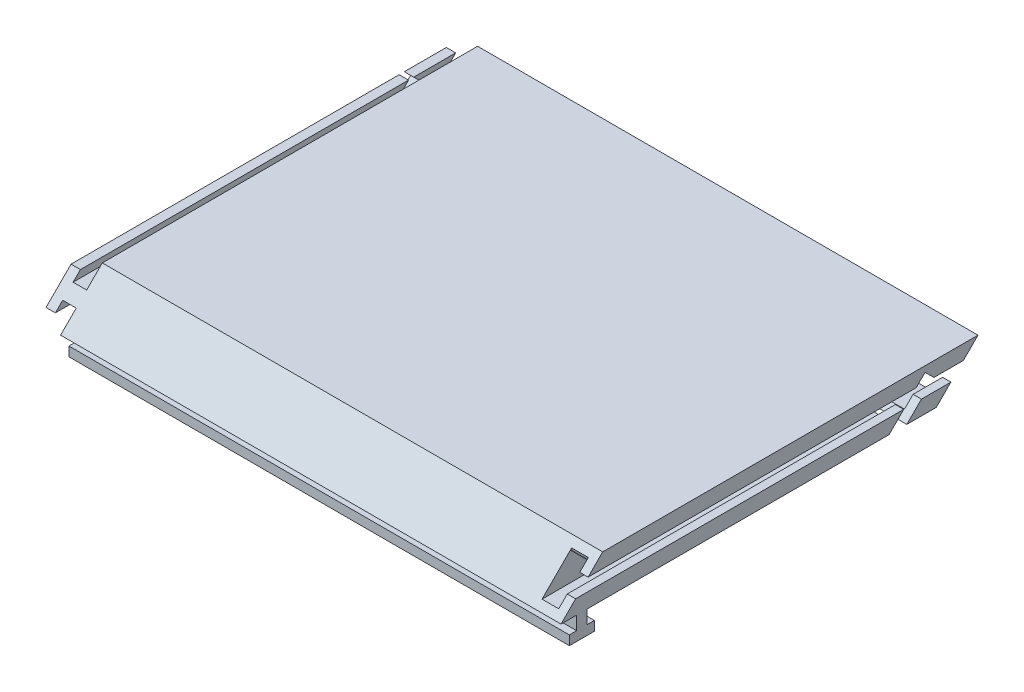
from build123d import *

# Parameters (mm, degrees)
SKETCH1_W           = 120
SKETCH1_H           = 100
BOSS_EXTRUDE1_DEPTH = 10
SKETCH2_W           = 6
SKETCH2_H           = 3
CUT_EXTRUDE1_DEPTH  = 120
SKETCH3_W           = 3
SKETCH3_H           = 1.75
CUT_EXTRUDE2_DEPTH  = 120
SKETCH4_W           = 3
SKETCH4_H           = 1.75
CUT_EXTRUDE3_DEPTH  = 120
SKETCH5_W           = 100
SKETCH5_H           = 3
BOSS_EXTRUDE2_DEPTH = 6
SKETCH6_W           = 3
SKETCH6_H           = 100
BOSS_EXTRUDE3_DEPTH = 1.75
SKETCH8_W           = 3
SKETCH8_H           = 100
BOSS_EXTRUDE4_DEPTH = 1.75
CUT_EXTRUDE4_DEPTH  = 140
CUT_EXTRUDE5_DEPTH  = 140
SKETCH12_W          = 120
SKETCH12_H          = 3
BOSS_EXTRUDE5_DEPTH = 6
SKETCH13_W          = 120
SKETCH13_H          = 3
BOSS_EXTRUDE6_DEPTH = 1.75
SKETCH14_W          = 120
SKETCH14_H          = 3
BOSS_EXTRUDE7_DEPTH = 1.75
SKETCH15_W          = 3.971349668
SKETCH15_H          = 100.27962334
CUT_EXTRUDE7_DEPTH  = 0.25
SKETCH16_W          = 3.977727367
SKETCH16_H          = 100.113606744
CUT_EXTRUDE8_DEPTH  = 0.25
SKETCH18_W          = 99.392543401
SKETCH18_H          = 7.459446395
CUT_EXTRUDE9_DEPTH  = 0.25
SKETCH19_W          = 3
SKETCH19_H          = 91.258373497
CUT_EXTRUDE10_DEPTH = 0.25
SKETCH22_W          = 3
SKETCH22_H          = 105.56058455
CUT_EXTRUDE11_DEPTH = 0.25
SKETCH23_W          = 145.417072626
SKETCH23_H          = 16.376201687
CUT_EXTRUDE12_DEPTH = 0.25
SKETCH24_W          = 92.054908244
SKETCH24_H          = 1.75
CUT_EXTRUDE13_DEPTH = 0.25
SKETCH25_W          = 91.75
SKETCH25_H          = 1.75
CUT_EXTRUDE14_DEPTH = 0.25
SKETCH27_W          = 146.123968395
SKETCH27_H          = 10.969132505
CUT_EXTRUDE15_DEPTH = 0.25
SKETCH28_W          = 131.910387722
SKETCH28_H          = 9.70209764
CUT_EXTRUDE16_DEPTH = 0.25
SKETCH29_W          = 147.06215687
SKETCH29_H          = 25.738379838
CUT_EXTRUDE17_DEPTH = 0.25
SKETCH30_W          = 120
SKETCH30_H          = 3
CUT_EXTRUDE18_DEPTH = 0.25
SKETCH31_W          = 120
SKETCH31_H          = 3
CUT_EXTRUDE19_DEPTH = 0.25
SKETCH32_W          = 120
SKETCH32_H          = 1.75
CUT_EXTRUDE20_DEPTH = 0.25
SKETCH33_W          = 120
SKETCH33_H          = 1.75
CUT_EXTRUDE21_DEPTH = 0.25
SKETCH36_W          = 96.5
SKETCH36_H          = 6.5
CUT_EXTRUDE23_DEPTH = 0.5
SKETCH39_W          = 96.5
SKETCH39_H          = 6.5
CUT_EXTRUDE27_DEPTH = 0.5
SKETCH41_W          = 4
SKETCH41_H          = 91.70363903
CUT_EXTRUDE28_DEPTH = 0.3
SKETCH42_W          = 3.987472746
SKETCH42_H          = 92.170181705
CUT_EXTRUDE29_DEPTH = 0.3
CUT_EXTRUDE30_DEPTH = 150
SKETCH44_W          = 120
SKETCH44_H          = 6
CUT_EXTRUDE31_DEPTH = 0.25
CUT_EXTRUDE32_DEPTH = 150


with BuildPart() as part:
    # Sketch1 → Boss-Extrude1 (new body)
    with BuildSketch(Plane(origin=(0, 0, 0), x_dir=(1, 0, 0), z_dir=(0, 1, 0))):
        with Locations((-60, -57.341499956)):
            Rectangle(SKETCH1_W, SKETCH1_H)
    extrude(amount=BOSS_EXTRUDE1_DEPTH)

    # Sketch2 → Cut-Extrude1 (cut)
    with BuildSketch(Plane(origin=(0, 0, 7.341499956), x_dir=(-1, 0, 0), z_dir=(0, 0, -1))):
        with Locations((3, 5)):
            Rectangle(SKETCH2_W, SKETCH2_H)
    extrude(amount=-CUT_EXTRUDE1_DEPTH, mode=Mode.SUBTRACT)

    # Sketch3 → Cut-Extrude2 (cut)
    with BuildSketch(Plane(origin=(0, 0, 7.341499956), x_dir=(-1, 0, 0), z_dir=(0, 0, -1))):
        with Locations((4.5, 7.375)):
            Rectangle(SKETCH3_W, SKETCH3_H)
    extrude(amount=-CUT_EXTRUDE2_DEPTH, mode=Mode.SUBTRACT)

    # Sketch4 → Cut-Extrude3 (cut)
    with BuildSketch(Plane(origin=(0, 0, 7.341499956), x_dir=(-1, 0, 0), z_dir=(0, 0, -1))):
        with Locations((4.5, 2.625)):
            Rectangle(SKETCH4_W, SKETCH4_H)
    extrude(amount=-CUT_EXTRUDE3_DEPTH, mode=Mode.SUBTRACT)

    # Sketch5 → Boss-Extrude2 (add)
    with BuildSketch(Plane.ZY.offset(120)):
        with Locations((57.341499956, 5)):
            Rectangle(SKETCH5_W, SKETCH5_H)
    extrude(amount=BOSS_EXTRUDE2_DEPTH)

    # Sketch6 → Boss-Extrude3 (add)
    with BuildSketch(Plane(origin=(0, 3.5, 0), x_dir=(-1, 0, 0), z_dir=(0, -1, 0))):
        with Locations((124.5, -57.341499956)):
            Rectangle(SKETCH6_W, SKETCH6_H)
    extrude(amount=BOSS_EXTRUDE3_DEPTH)

    # Sketch8 → Boss-Extrude4 (add)
    with BuildSketch(Plane(origin=(0, 6.5, 0), x_dir=(1, 0, 0), z_dir=(0, 1, 0))):
        with Locations((-124.5, -57.341499956)):
            Rectangle(SKETCH8_W, SKETCH8_H)
    extrude(amount=BOSS_EXTRUDE4_DEPTH)

    # Sketch9 → Cut-Extrude4 (cut)
    with BuildSketch(Plane(origin=(0, 0, 0), x_dir=(0, 0, -1), z_dir=(1, 0, 0))):
        Polygon((-7.341499956, 0), (-7.341499956, 10), (-17.341499956, 0), align=None)
    extrude(amount=-CUT_EXTRUDE4_DEPTH, mode=Mode.SUBTRACT)

    # Sketch10 → Cut-Extrude5 (cut)
    with BuildSketch(Plane(origin=(0, 0, 0), x_dir=(0, 0, -1), z_dir=(1, 0, 0))):
        Polygon((-107.341499956, 10), (-107.341499956, 0), (-97.341499956, 10), align=None)
    extrude(amount=-CUT_EXTRUDE5_DEPTH, mode=Mode.SUBTRACT)

    # Sketch12 → Boss-Extrude5 (add)
    with BuildSketch(Plane(origin=(0, 0, 0), x_dir=(-1, 0, 0), z_dir=(0, -1, 0))):
        with Locations((60, -102.341499956)):
            Rectangle(SKETCH12_W, SKETCH12_H)
    extrude(amount=BOSS_EXTRUDE5_DEPTH)

    # Sketch13 → Boss-Extrude6 (add)
    with BuildSketch(Plane(origin=(0, 0, 100.841499956), x_dir=(-1, 0, 0), z_dir=(0, 0, -1))):
        with Locations((60, -4.5)):
            Rectangle(SKETCH13_W, SKETCH13_H)
    extrude(amount=BOSS_EXTRUDE6_DEPTH)

    # Sketch14 → Boss-Extrude7 (add)
    with BuildSketch(Plane.XY.offset(103.841499956)):
        with Locations((-60, -4.5)):
            Rectangle(SKETCH14_W, SKETCH14_H)
    extrude(amount=BOSS_EXTRUDE7_DEPTH)

    # Sketch15 → Cut-Extrude7 (cut)
    with BuildSketch(Plane(origin=(0, 1.75, 0), x_dir=(-1, 0, 0), z_dir=(0, -1, 0))):
        with Locations((124.014325166, -55.451688286)):
            Rectangle(SKETCH15_W, SKETCH15_H)
    extrude(amount=-CUT_EXTRUDE7_DEPTH, mode=Mode.SUBTRACT)

    # Sketch16 → Cut-Extrude8 (cut)
    with BuildSketch(Plane(origin=(0, 8.25, 0), x_dir=(1, 0, 0), z_dir=(0, 1, 0))):
        with Locations((-124.011136317, -59.148303328)):
            Rectangle(SKETCH16_W, SKETCH16_H)
    extrude(amount=-CUT_EXTRUDE8_DEPTH, mode=Mode.SUBTRACT)

    # Sketch18 → Cut-Extrude9 (cut)
    with BuildSketch(Plane.ZY.offset(126)):
        with Locations((55.645228256, 5.729723198)):
            Rectangle(SKETCH18_W, SKETCH18_H)
    extrude(amount=-CUT_EXTRUDE9_DEPTH, mode=Mode.SUBTRACT)

    # Sketch19 → Cut-Extrude10 (cut)
    with BuildSketch(Plane(origin=(0, 6.5, 0), x_dir=(1, 0, 0), z_dir=(0, 1, 0))):
        with Locations((-121.5, -56.470686704)):
            Rectangle(SKETCH19_W, SKETCH19_H)
    extrude(amount=-CUT_EXTRUDE10_DEPTH, mode=Mode.SUBTRACT)

    # Sketch22 → Cut-Extrude11 (cut)
    with BuildSketch(Plane(origin=(0, 3.5, 0), x_dir=(-1, 0, 0), z_dir=(0, -1, 0))):
        with Locations((121.5, -51.061207681)):
            Rectangle(SKETCH22_W, SKETCH22_H)
    extrude(amount=-CUT_EXTRUDE11_DEPTH, mode=Mode.SUBTRACT)

    # Sketch23 → Cut-Extrude12 (cut)
    with BuildSketch(Plane.ZY.offset(125.75)):
        with Locations((82.050036269, -0.188100844)):
            Rectangle(SKETCH23_W, SKETCH23_H)
    extrude(amount=-CUT_EXTRUDE12_DEPTH, mode=Mode.SUBTRACT)

    # Sketch24 → Cut-Extrude13 (cut)
    with BuildSketch(Plane(origin=(-123, 0, 0), x_dir=(0, 0, -1), z_dir=(1, 0, 0))):
        with Locations((-59.314045834, 2.875)):
            Rectangle(SKETCH24_W, SKETCH24_H)
    extrude(amount=-CUT_EXTRUDE13_DEPTH, mode=Mode.SUBTRACT)

    # Sketch25 → Cut-Extrude14 (cut)
    with BuildSketch(Plane(origin=(-123, 0, 0), x_dir=(0, 0, -1), z_dir=(1, 0, 0))):
        with Locations((-55.216499956, 7.125)):
            Rectangle(SKETCH25_W, SKETCH25_H)
    extrude(amount=-CUT_EXTRUDE14_DEPTH, mode=Mode.SUBTRACT)

    # Sketch27 → Cut-Extrude15 (cut)
    with BuildSketch(Plane(origin=(0, -6, 0), x_dir=(-1, 0, 0), z_dir=(0, -1, 0))):
        with Locations((46.938015803, -100.106933704)):
            Rectangle(SKETCH27_W, SKETCH27_H)
    extrude(amount=-CUT_EXTRUDE15_DEPTH, mode=Mode.SUBTRACT)

    # Sketch28 → Cut-Extrude16 (cut)
    with BuildSketch(Plane.XY.offset(105.591499956)):
        with Locations((-65.955193861, -7.85104882)):
            Rectangle(SKETCH28_W, SKETCH28_H)
    extrude(amount=-CUT_EXTRUDE16_DEPTH, mode=Mode.SUBTRACT)

    # Sketch29 → Cut-Extrude17 (cut)
    with BuildSketch(Plane(origin=(0, 0, 99.091499956), x_dir=(-1, 0, 0), z_dir=(0, 0, -1))):
        with Locations((46.468921565, -15.869189919)):
            Rectangle(SKETCH29_W, SKETCH29_H)
    extrude(amount=-CUT_EXTRUDE17_DEPTH, mode=Mode.SUBTRACT)

    # Sketch30 → Cut-Extrude18 (cut)
    with BuildSketch(Plane(origin=(0, 0, 100.841499956), x_dir=(-1, 0, 0), z_dir=(0, 0, -1))):
        with Locations((60, -1.5)):
            Rectangle(SKETCH30_W, SKETCH30_H)
    extrude(amount=-CUT_EXTRUDE18_DEPTH, mode=Mode.SUBTRACT)

    # Sketch31 → Cut-Extrude19 (cut)
    with BuildSketch(Plane.XY.offset(103.841499956)):
        with Locations((-60, -1.5)):
            Rectangle(SKETCH31_W, SKETCH31_H)
    extrude(amount=-CUT_EXTRUDE19_DEPTH, mode=Mode.SUBTRACT)

    # Sketch32 → Cut-Extrude20 (cut)
    with BuildSketch(Plane(origin=(0, -3, 0), x_dir=(1, 0, 0), z_dir=(0, 1, 0))):
        with Locations((-60, -104.466499956)):
            Rectangle(SKETCH32_W, SKETCH32_H)
    extrude(amount=-CUT_EXTRUDE20_DEPTH, mode=Mode.SUBTRACT)

    # Sketch33 → Cut-Extrude21 (cut)
    with BuildSketch(Plane(origin=(0, -3, 0), x_dir=(1, 0, 0), z_dir=(0, 1, 0))):
        with Locations((-60, -100.216499956)):
            Rectangle(SKETCH33_W, SKETCH33_H)
    extrude(amount=-CUT_EXTRUDE21_DEPTH, mode=Mode.SUBTRACT)

    # Sketch36 → Cut-Extrude23 (cut)
    with BuildSketch(Plane.ZY.offset(3)):
        with Locations((57.341499956, 5)):
            Rectangle(SKETCH36_W, SKETCH36_H)
    extrude(amount=-CUT_EXTRUDE23_DEPTH, mode=Mode.SUBTRACT)

    # Sketch39 → Cut-Extrude27 (cut)
    with BuildSketch(Plane.ZY.offset(2.5)):
        with Locations((57.341499956, 5)):
            Rectangle(SKETCH39_W, SKETCH39_H)
    extrude(amount=-CUT_EXTRUDE27_DEPTH, mode=Mode.SUBTRACT)

    # Sketch41 → Cut-Extrude28 (cut)
    with BuildSketch(Plane(origin=(0, 1.75, 0), x_dir=(1, 0, 0), z_dir=(0, 1, 0))):
        with Locations((-4, -61.443319471)):
            Rectangle(SKETCH41_W, SKETCH41_H)
    extrude(amount=-CUT_EXTRUDE28_DEPTH, mode=Mode.SUBTRACT)

    # Sketch42 → Cut-Extrude29 (cut)
    with BuildSketch(Plane(origin=(0, 8.25, 0), x_dir=(-1, 0, 0), z_dir=(0, -1, 0))):
        with Locations((3.993736373, -52.972884842)):
            Rectangle(SKETCH42_W, SKETCH42_H)
    extrude(amount=-CUT_EXTRUDE29_DEPTH, mode=Mode.SUBTRACT)

    # Sketch43 → Cut-Extrude30 (cut)
    with BuildSketch(Plane(origin=(0, 0, 0), x_dir=(0, 0, -1), z_dir=(1, 0, 0))):
        Polygon((-19.32678133, 7.914213562), (-33.468916954, -6.227922061), (-32.054703391, -7.642135624), (-17.912567767, 6.5), align=None)
    extrude(amount=-CUT_EXTRUDE30_DEPTH, mode=Mode.SUBTRACT)

    # Sketch44 → Cut-Extrude31 (cut)
    with BuildSketch(Plane(origin=(0, -5.75, 0), x_dir=(-1, 0, 0), z_dir=(0, -1, 0))):
        with Locations((60, -102.341499956)):
            Rectangle(SKETCH44_W, SKETCH44_H)
    extrude(amount=-CUT_EXTRUDE31_DEPTH, mode=Mode.SUBTRACT)

    # Sketch45 → Cut-Extrude32 (cut)
    with BuildSketch(Plane(origin=(0, 0, 0), x_dir=(0, 0, -1), z_dir=(1, 0, 0))):
        Polygon((-19.32678133, 7.914213562), (-20.033888111, 8.621320344), (-29.487832781, -0.832624327), (-28.780726, -1.539731108), align=None)
    extrude(amount=-CUT_EXTRUDE32_DEPTH, mode=Mode.SUBTRACT)


solid = part.part
